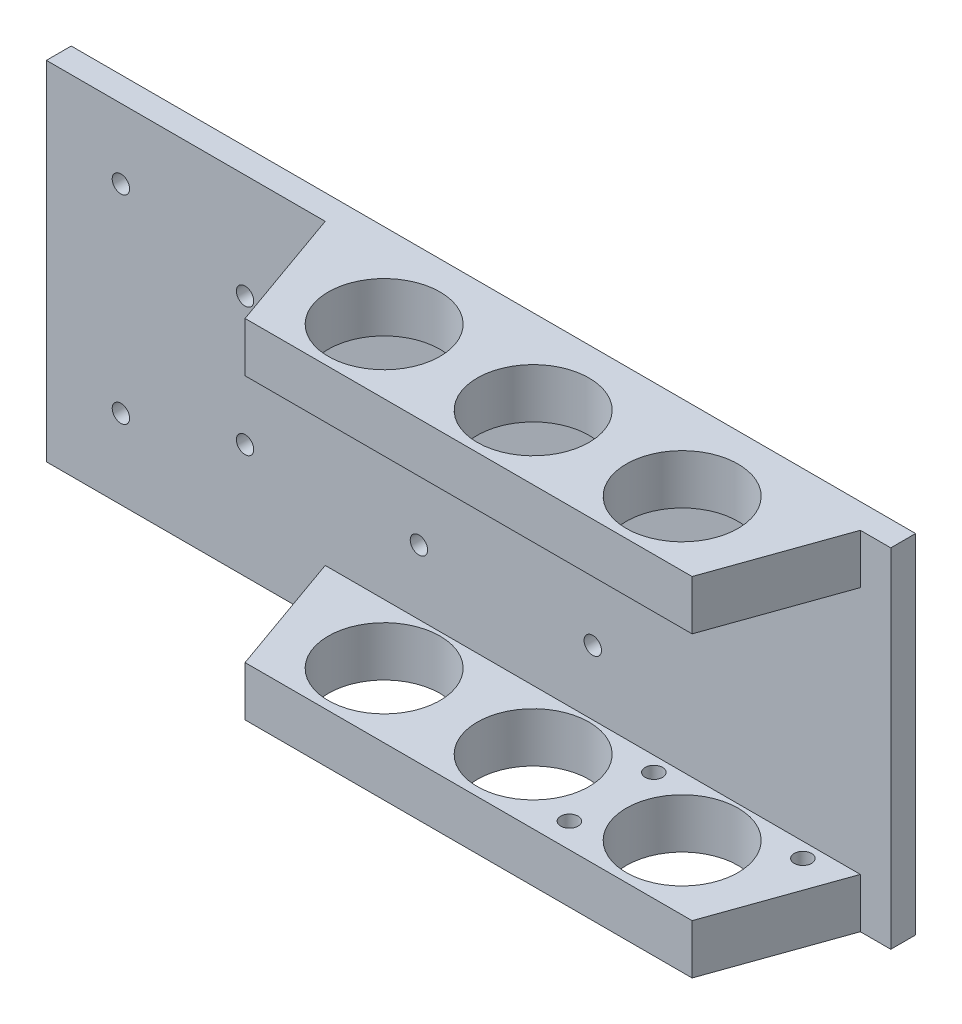
from build123d import *

# Parameters (mm, degrees)
SKETCH_1_R          = 11.25
EXTRUDE_1_DEPTH     = 35
SKETCH_2_W          = 25
SKETCH_2_H          = 50
CUT_EXTRUDE1_DEPTH  = 147.905581923
SKETCH1_W           = 30
SKETCH1_H           = 70
BOSS_EXTRUDE1_DEPTH = 5
SKETCH3_R           = 1.75
CUT_EXTRUDE4_DEPTH  = 10
SKETCH_3_R          = 1.75
CUT_EXTRUDE_2_DEPTH = 10


with BuildPart() as part:
    # Эскиз1 → Бобышка-Вытянуть1 (new, symmetric)
    with BuildSketch(Plane(origin=(0, 0, 0), x_dir=(1, 0, 0), z_dir=(0, 1, 0))):
        Polygon((-60, -2.5), (-53.870442851, -2.5), (-45, -27.5), (45, -27.5), (53.870442851, -2.5), (60, -2.5), (60, 2.5), (-60, 2.5), (-80, 2.5), (-80, -2.5), align=None)
        with Locations(Location((0, -14.5, 0), (0, 0, 270))):
            Circle(SKETCH_1_R, mode=Mode.SUBTRACT)
        with Locations(Location((30, -14.5, 0), (0, 0, 270))):
            Circle(SKETCH_1_R, mode=Mode.SUBTRACT)
        with Locations(Location((-30, -14.5, 0), (0, 0, 90))):
            Circle(SKETCH_1_R, mode=Mode.SUBTRACT)
    extrude(amount=EXTRUDE_1_DEPTH, both=True)

    # Эскиз2 → Cut-Extrude1 (cut, through all)
    with BuildSketch(Plane.ZY.offset(80)):
        with Locations((15, 0)):
            Rectangle(SKETCH_2_W, SKETCH_2_H)
    extrude(amount=-CUT_EXTRUDE1_DEPTH, mode=Mode.SUBTRACT)

    # Sketch1 → Boss-Extrude1 (add)
    with BuildSketch(Plane(origin=(0, 0, -2.5), x_dir=(-1, 0, 0), z_dir=(0, 0, -1))):
        with Locations((95, 0)):
            Rectangle(SKETCH1_W, SKETCH1_H)
    extrude(amount=-BOSS_EXTRUDE1_DEPTH)

    # Sketch3 → Cut-Extrude4 (cut)
    with BuildSketch(Plane.XZ.offset(35)):
        with Locations(Location((45.3, 5.5, 0), (0, 0, 270))):
            Circle(SKETCH3_R)
        with Locations(Location((15.3, 22.5, 0), (0, 0, 270))):
            Circle(SKETCH3_R)
        with Locations(Location((15.3, 5.5, 0), (0, 0, 270))):
            Circle(SKETCH3_R)
    extrude(amount=-CUT_EXTRUDE4_DEPTH, mode=Mode.SUBTRACT)

    # Эскиз3 → Вырез-Вытянуть2 (cut)
    with BuildSketch(Plane(origin=(0, 0, -2.5), x_dir=(-1, 0, 0), z_dir=(0, 0, -1))):
        with Locations((0, -12)):
            Circle(SKETCH_3_R)
        with Locations((35, -12)):
            Circle(SKETCH_3_R)
        with Locations((70, -12)):
            Circle(SKETCH_3_R)
        with Locations((35, 13.91)):
            Circle(SKETCH_3_R)
        with Locations((70, 13.91)):
            Circle(SKETCH_3_R)
        with Locations((0, 13.91)):
            Circle(SKETCH_3_R)
        with Locations((95, 20.955)):
            Circle(SKETCH_3_R)
        with Locations((95, -19.045)):
            Circle(SKETCH_3_R)
    extrude(amount=-CUT_EXTRUDE_2_DEPTH, mode=Mode.SUBTRACT)


solid = part.part
